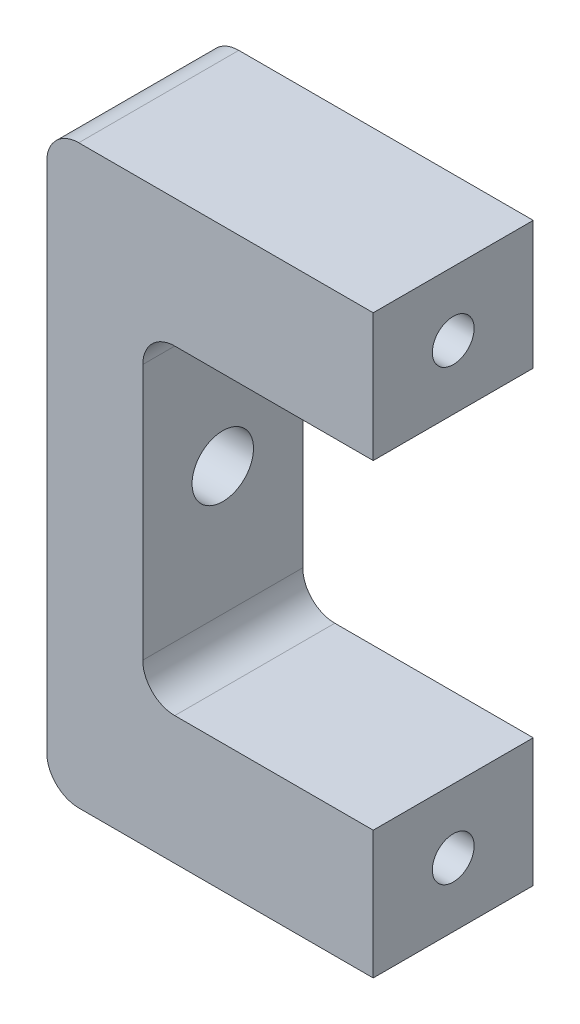
from build123d import *

# Parameters (mm, degrees)
BOSS_EXTRUDE1_DEPTH                              = 25
SKETCH3_R                                        = 4.8
CUT_EXTRUDE1_DEPTH                               = 7.5
FILLET1_R                                        = 5
CBORE_FOR_1_4_SOCKET_HEAD_CAP_SCREW1_D           = 6.5278
CBORE_FOR_1_4_SOCKET_HEAD_CAP_SCREW1_CBORE_D     = 11.1125
CBORE_FOR_1_4_SOCKET_HEAD_CAP_SCREW1_CBORE_DEPTH = 22.225


with BuildPart() as part:
    # Sketch2 → Boss-Extrude1 (new body)
    with BuildSketch(Plane.XY):
        Polygon((-18, 25), (18, 25), (18, 45), (-33, 45), (-33, -45), (18, -45), (18, -25), (-18, -25), align=None)
    extrude(amount=BOSS_EXTRUDE1_DEPTH)

    # Sketch3 → Cut-Extrude1 (cut)
    with BuildSketch(Plane(origin=(-18, 0, 0), x_dir=(0, 0, -1), z_dir=(1, 0, 0))):
        with Locations(Location((-12.5, 0, 0), (0, 0, 90))):
            Circle(SKETCH3_R)
    extrude(amount=-CUT_EXTRUDE1_DEPTH, mode=Mode.SUBTRACT)

    # Fillet1
    fillet1_edges = [part.edges().sort_by_distance(p)[0] for p in [
        (-33, -45, 12.5),
        (-33, 45, 12.5),
        (-18, 25, 12.5),
        (-18, -25, 12.5),
    ]]
    fillet(fillet1_edges, radius=FILLET1_R)

    # CBORE for 1/4 Socket Head Cap Screw1 (through all)
    with Locations(Plane.ZY.offset(33)):
        with Locations((12.5, 35), (12.5, -35)):
            CounterBoreHole(CBORE_FOR_1_4_SOCKET_HEAD_CAP_SCREW1_D / 2, CBORE_FOR_1_4_SOCKET_HEAD_CAP_SCREW1_CBORE_D / 2, CBORE_FOR_1_4_SOCKET_HEAD_CAP_SCREW1_CBORE_DEPTH)


solid = part.part
